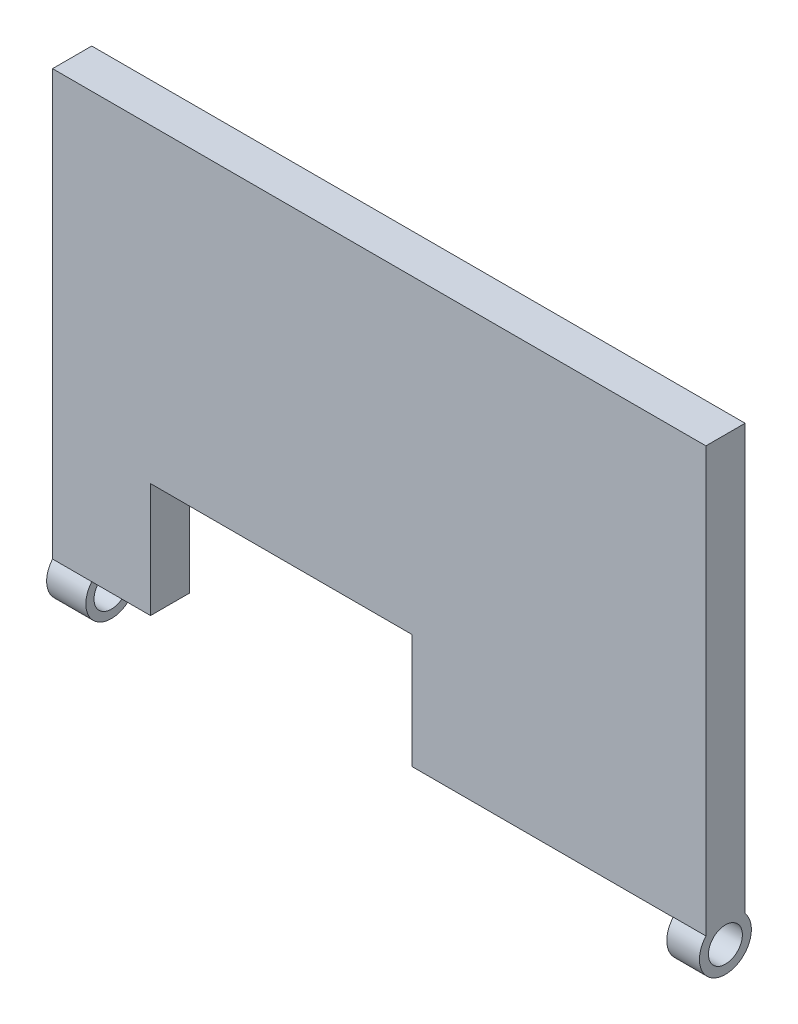
from build123d import *

# Parameters (mm, degrees)
EXTRUDE_1_DEPTH     = 6
SKETCH_2_R          = 3.905124838
SKETCH_2_R_2        = 2.65
EXTRUDE_6_DEPTH     = 6
SKETCH_3_R          = 3.972728699
EXTRUDE_7_DEPTH     = 5
CUT_EXTRUDE_START   = -0.8
SKETCH_4_R          = 2.6
CUT_EXTRUDE_1_DEPTH = 4.2
SKETCH_5_W          = 40
SKETCH_5_H          = 17.5
CUT_EXTRUDE_2_DEPTH = 10


with BuildPart() as part:
    # 草图1 → 凸台-拉伸1 (new body)
    with BuildSketch(Plane.XY):
        Polygon((0, 0), (50, 0), (50, 65), (-50, 65), (-50, 0), align=None)
    extrude(amount=EXTRUDE_1_DEPTH)

    # 草图2 → 凸台-拉伸6 (add)
    with BuildSketch(Plane.ZY.offset(50)):
        with Locations((3, -2.5)):
            Circle(SKETCH_2_R)
        with Locations((3, -2.5)):
            Circle(SKETCH_2_R_2, mode=Mode.SUBTRACT)
    extrude(amount=-EXTRUDE_6_DEPTH)

    # 草图3 → 凸台-拉伸7 (add)
    with BuildSketch(Plane(origin=(50, 0, 0), x_dir=(0, 0, -1), z_dir=(1, 0, 0))):
        with Locations((-3.014231345, -2.587852917)):
            Circle(SKETCH_3_R)
    extrude(amount=-EXTRUDE_7_DEPTH)

    # 草图4 → 切除-拉伸1 (cut)
    with BuildSketch(Plane.ZY.offset(-45).offset(CUT_EXTRUDE_START)):
        with Locations((3.014231345, -2.587852917)):
            Circle(SKETCH_4_R)
    extrude(amount=-CUT_EXTRUDE_1_DEPTH, mode=Mode.SUBTRACT)

    # 草图5 → 切除-拉伸2 (cut)
    with BuildSketch(Plane.XY.offset(6)):
        with Locations((-15, 8.75)):
            Rectangle(SKETCH_5_W, SKETCH_5_H)
    extrude(amount=-CUT_EXTRUDE_2_DEPTH, mode=Mode.SUBTRACT)


solid = part.part
